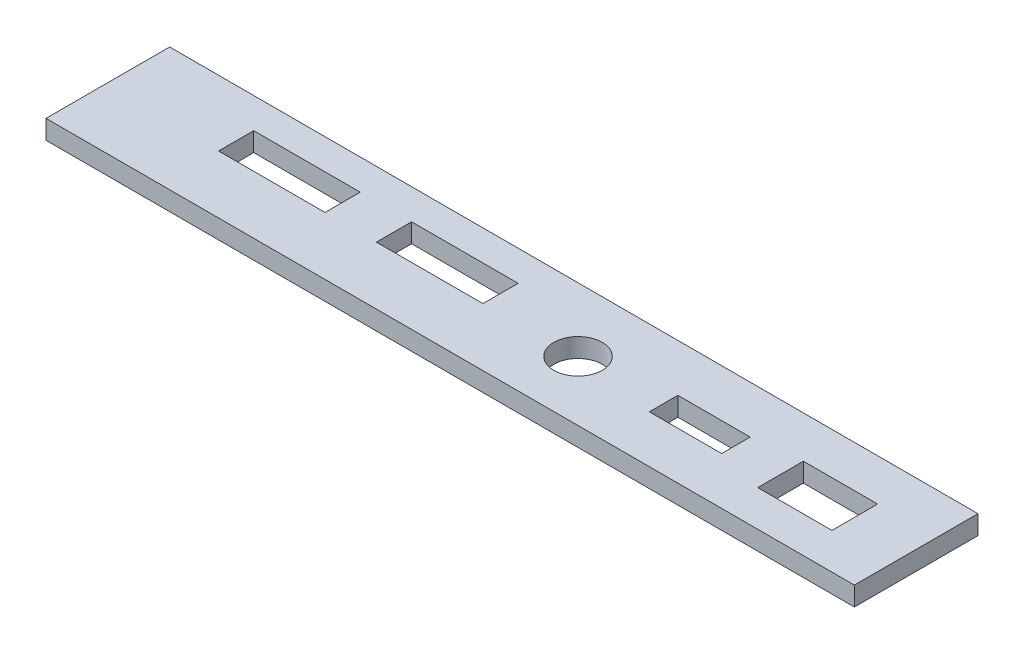
from build123d import *

# Parameters (mm, degrees)
SKETCH_1_W      = 85
SKETCH_1_H      = 13
SKETCH_1_R      = 2.55
SKETCH_1_W_2    = 7.8
SKETCH_1_H_2    = 4.8
SKETCH_1_W_3    = 7.6
SKETCH_1_H_3    = 3
SKETCH_1_W_4    = 11.2
SKETCH_1_H_4    = 3.7
EXTRUDE_5_DEPTH = 2


with BuildPart() as part:
    # 草图1 → 凸台-拉伸5 (new body)
    with BuildSketch(Plane(origin=(0, 0, 0), x_dir=(1, 0, 0), z_dir=(0, 1, 0))):
        with Locations((32.448630137, -2.468848032)):
            Rectangle(SKETCH_1_W, SKETCH_1_H)
        with Locations(Location((39.591348171, -2.668848032, 0), (0, 0, 270))):
            Circle(SKETCH_1_R, mode=Mode.SUBTRACT)
        with Locations((64.891348171, -2.768848032)):
            Rectangle(SKETCH_1_W_2, SKETCH_1_H_2, mode=Mode.SUBTRACT)
        with Locations((52.191348171, -2.468848032)):
            Rectangle(SKETCH_1_W_3, SKETCH_1_H_3, mode=Mode.SUBTRACT)
        with Locations((24.191348171, -1.018848032)):
            Rectangle(SKETCH_1_W_4, SKETCH_1_H_4, mode=Mode.SUBTRACT)
        with Locations((7.591348171, -1.018848032)):
            Rectangle(SKETCH_1_W_4, SKETCH_1_H_4, mode=Mode.SUBTRACT)
    extrude(amount=EXTRUDE_5_DEPTH)


solid = part.part
